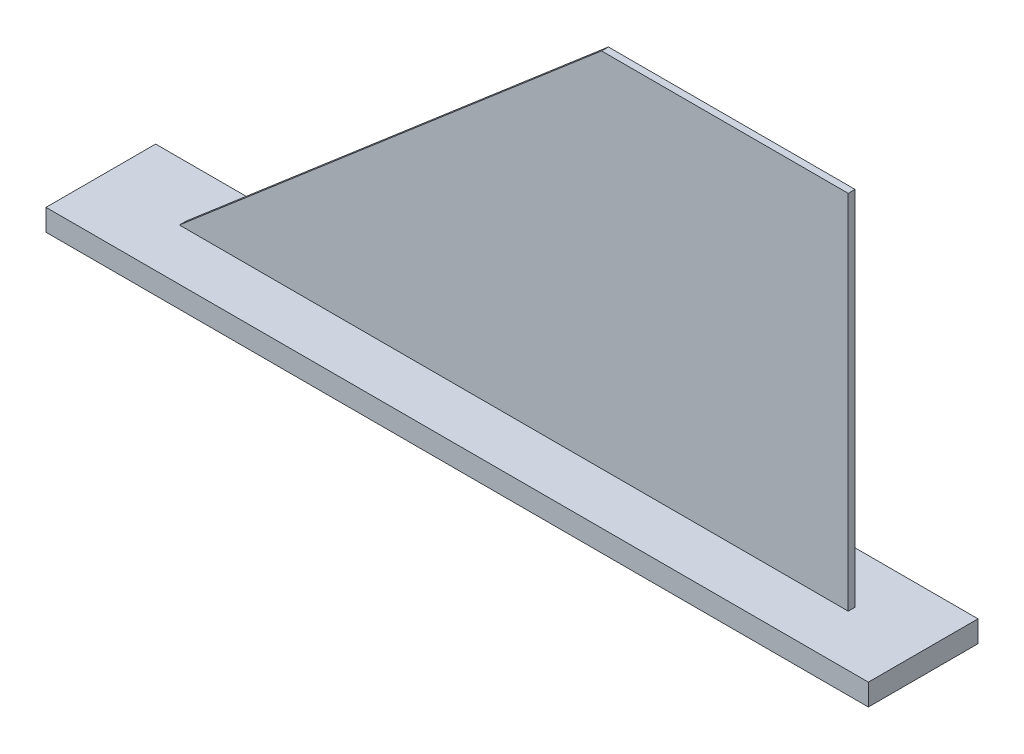
from build123d import *

# Parameters (mm, degrees)
SKETCH1_W                = 381
SKETCH1_H                = 50.8
BOSS_EXTRUDE1_DEPTH      = 10
BOSS_EXTRUDE2_DEPTH      = 1.5875
BOSS_EXTRUDE2_DEPTH_BACK = 1.5875


with BuildPart() as part:
    # Sketch1 → Boss-Extrude1 (new body)
    with BuildSketch(Plane(origin=(0, 0, 0), x_dir=(1, 0, 0), z_dir=(0, 1, 0))):
        with Locations((190.5, 25.4)):
            Rectangle(SKETCH1_W, SKETCH1_H)
    extrude(amount=BOSS_EXTRUDE1_DEPTH)


with BuildPart() as body_2:
    # Sketch2 → Boss-Extrude2 (new, two sides: drawn at the far end of the back side and taken through both)
    with BuildSketch(Plane.XY.offset(-25.4).offset(-BOSS_EXTRUDE2_DEPTH_BACK)):
        Polygon((347.867965721, 10), (37.987965721, 10), (233.567965721, 177.64), (347.867965721, 177.64), align=None)
    extrude(amount=BOSS_EXTRUDE2_DEPTH + BOSS_EXTRUDE2_DEPTH_BACK)


solid = Compound([part.part, body_2.part])
